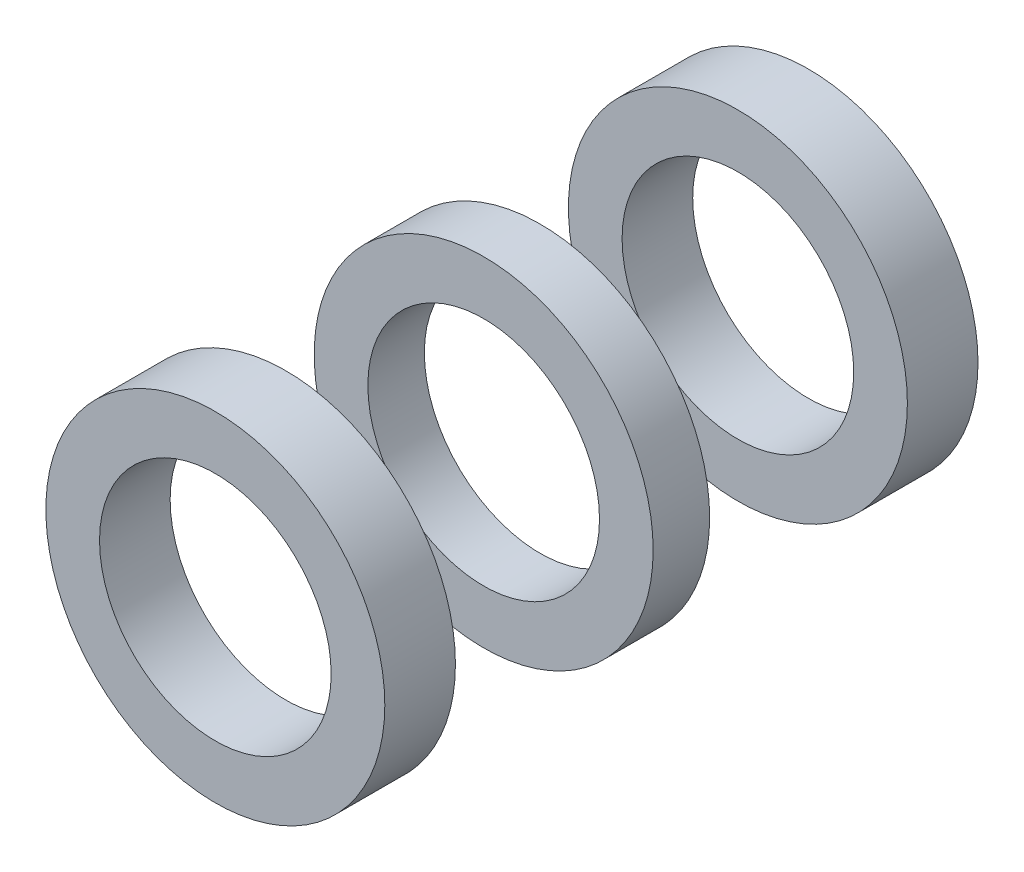
from build123d import *

# Parameters (mm, degrees)
REAR_START   = 34.5
SKETCH_1_R   = 6
SKETCH_1_R_2 = 4.1
REAR_DEPTH   = 2.5
MIDDLE_START = 44
SKETCH_2_R   = 6
SKETCH_2_R_2 = 4.1
MIDDLE_DEPTH = 2
FRONT_START  = 53
SKETCH_3_R   = 6
SKETCH_3_R_2 = 4.1
FRONT_DEPTH  = 2.5


with BuildPart() as part:
    # Эскиз1 → Rear (new body)
    with BuildSketch(Plane.XY.offset(REAR_START)):
        Circle(SKETCH_1_R)
        Circle(SKETCH_1_R_2, mode=Mode.SUBTRACT)
    extrude(amount=REAR_DEPTH)


with BuildPart() as body_2:
    # Эскиз2 → Middle (new body)
    with BuildSketch(Plane.XY.offset(MIDDLE_START)):
        Circle(SKETCH_2_R)
        Circle(SKETCH_2_R_2, mode=Mode.SUBTRACT)
    extrude(amount=MIDDLE_DEPTH)


with BuildPart() as body_3:
    # Эскиз3 → Front (new body)
    with BuildSketch(Plane.XY.offset(FRONT_START)):
        Circle(SKETCH_3_R)
        Circle(SKETCH_3_R_2, mode=Mode.SUBTRACT)
    extrude(amount=FRONT_DEPTH)


solid = Compound([part.part, body_2.part, body_3.part])
